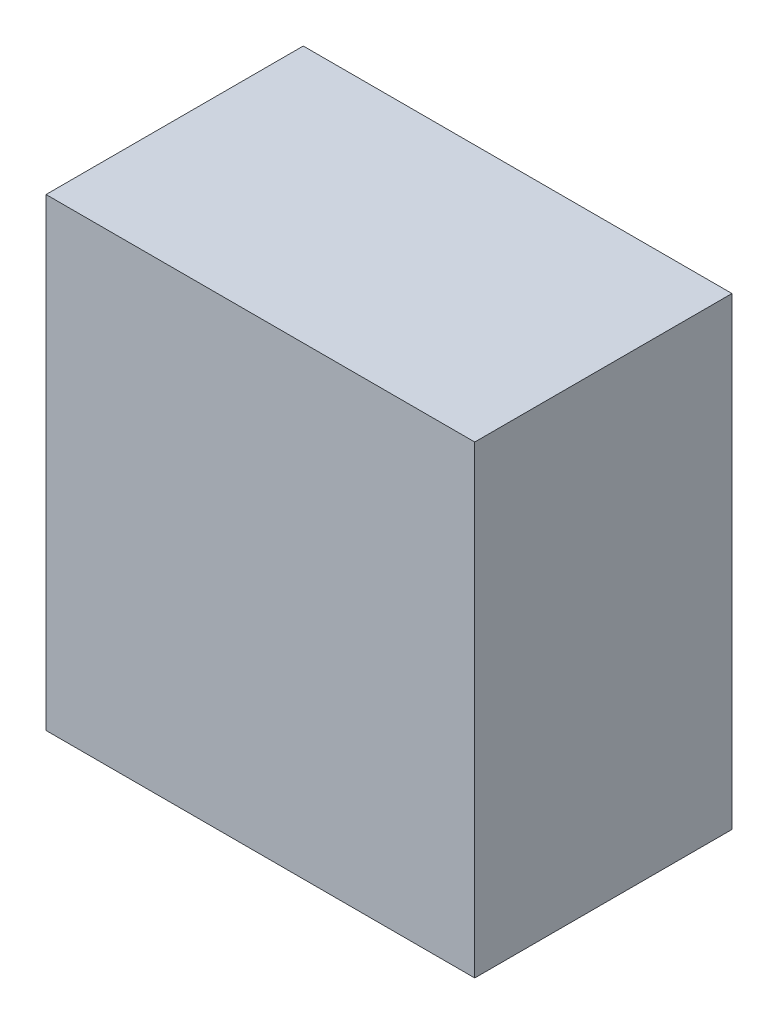
from build123d import *

# Parameters (mm, degrees)
SKETCH1_W           = 145
SKETCH1_H           = 157
BOSS_EXTRUDE1_DEPTH = 87


with BuildPart() as part:
    # Sketch1 → Boss-Extrude1 (new body)
    with BuildSketch(Plane.XY):
        with Locations((232.5, 26.29)):
            Rectangle(SKETCH1_W, SKETCH1_H)
    extrude(amount=BOSS_EXTRUDE1_DEPTH)


solid = part.part
